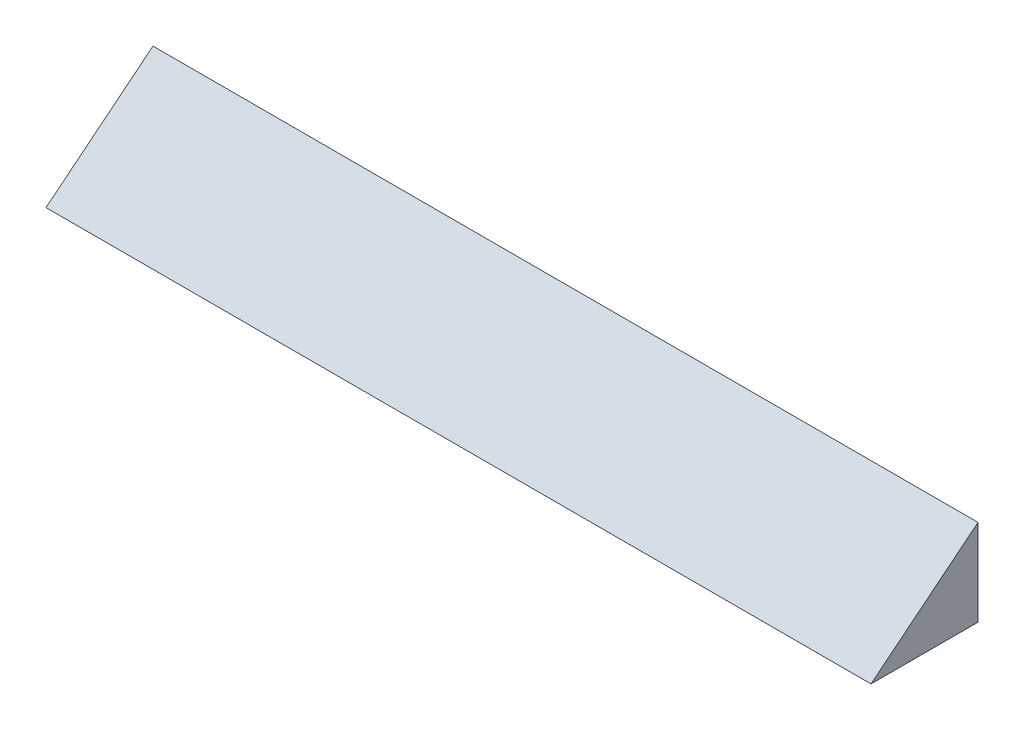
from build123d import *

# Parameters (mm, degrees)
BOSS_EXTRUDE1_DEPTH = 914.4


with BuildPart() as part:
    # Sketch1 → Boss-Extrude1 (new body)
    with BuildSketch(Plane(origin=(0, 0, 0), x_dir=(0, 0, -1), z_dir=(1, 0, 0))):
        Polygon((-44.696558743, 5.837917877), (73.86167712, 101.596492997), (73.86167712, 5.837917877), align=None)
    extrude(amount=BOSS_EXTRUDE1_DEPTH)


solid = part.part
